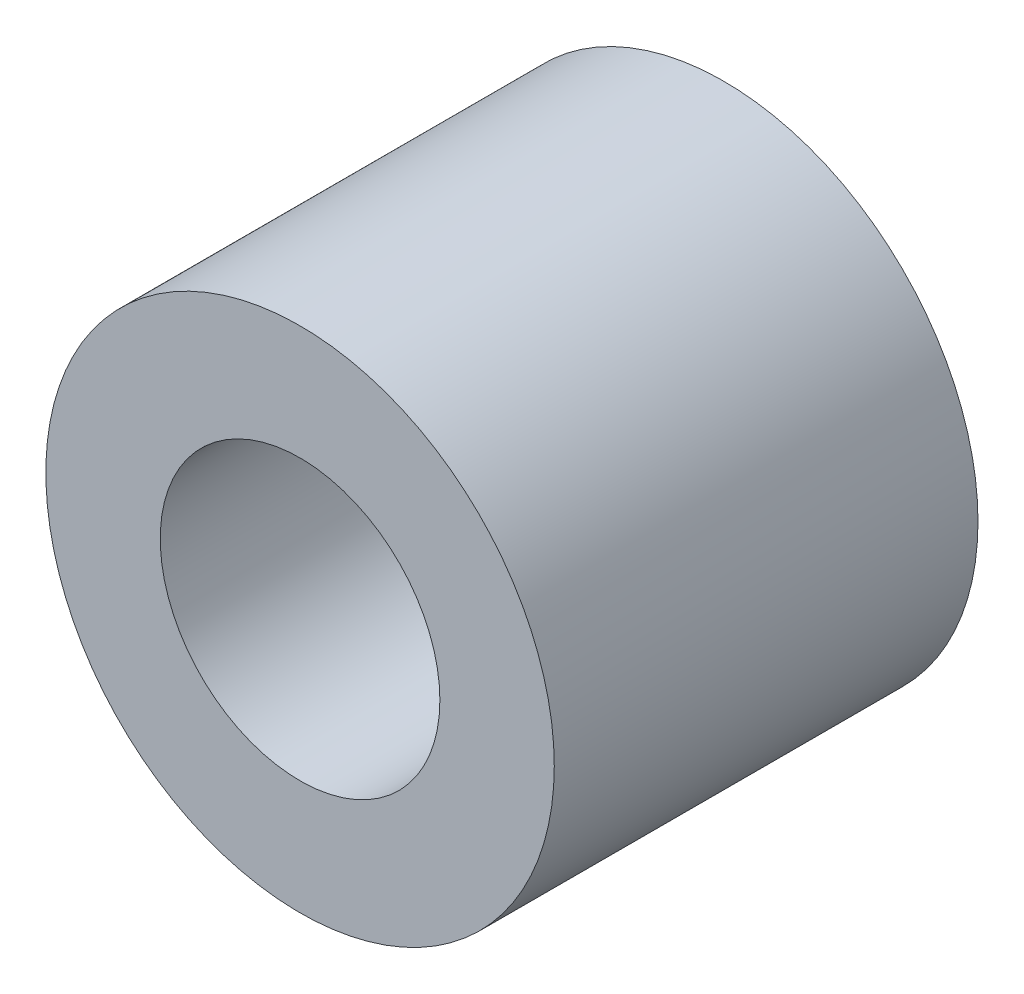
from build123d import *

# Parameters (mm, degrees)
SKETCH1_R           = 9.525
SKETCH1_R_2         = 5.23875
BOSS_EXTRUDE1_DEPTH = 7.9375


with BuildPart() as part:
    # Sketch1 → Boss-Extrude1 (new, symmetric)
    with BuildSketch(Plane.XY):
        Circle(SKETCH1_R)
        Circle(SKETCH1_R_2, mode=Mode.SUBTRACT)
    extrude(amount=BOSS_EXTRUDE1_DEPTH, both=True)


solid = part.part
